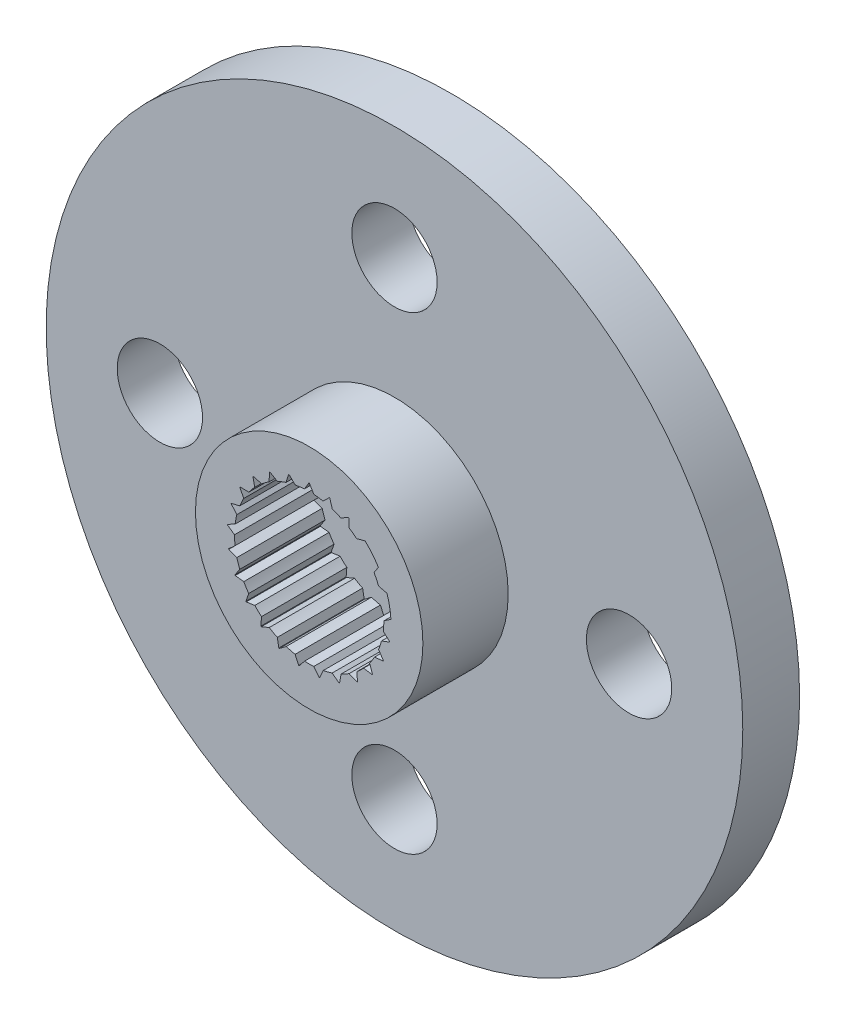
from build123d import *

# Parameters (mm, degrees)
SKETCH1_R           = 12.25
BOSS_EXTRUDE1_DEPTH = 2
SKETCH2_R           = 1.5
CUT_EXTRUDE1_DEPTH  = 2
SKETCH3_R           = 1.35
CUT_EXTRUDE2_DEPTH  = 4
SKETCH4_R           = 4
SKETCH4_R_2         = 2.88
BOSS_EXTRUDE2_DEPTH = 3
SKETCH6_R           = 2
CUT_EXTRUDE3_DEPTH  = 1
BOSS_EXTRUDE4_START = -3
BOSS_EXTRUDE4_DEPTH = 3


with BuildPart() as part:
    # Sketch1 → Boss-Extrude1 (new body)
    with BuildSketch(Plane.XY):
        Circle(SKETCH1_R)
    extrude(amount=BOSS_EXTRUDE1_DEPTH)

    # Sketch2 → Cut-Extrude1 (cut)
    with BuildSketch(Plane.XY.offset(2)):
        with Locations((-8.25, 0)):
            Circle(SKETCH2_R)
        with Locations((0, 8.25)):
            Circle(SKETCH2_R)
        with Locations((8.25, 0)):
            Circle(SKETCH2_R)
        with Locations((0, -8.25)):
            Circle(SKETCH2_R)
    extrude(amount=-CUT_EXTRUDE1_DEPTH, mode=Mode.SUBTRACT)

    # Sketch3 → Cut-Extrude2 (cut)
    with BuildSketch(Plane.XY.offset(2)):
        Circle(SKETCH3_R)
    extrude(amount=-CUT_EXTRUDE2_DEPTH, mode=Mode.SUBTRACT)

    # Sketch4 → Boss-Extrude2 (add)
    with BuildSketch(Plane.XY.offset(2)):
        Circle(SKETCH4_R)
        Circle(SKETCH4_R_2, mode=Mode.SUBTRACT)
    extrude(amount=BOSS_EXTRUDE2_DEPTH)

    # Sketch6 → Cut-Extrude3 (cut)
    with BuildSketch(Plane(origin=(0, 0, 0), x_dir=(-1, 0, 0), z_dir=(0, 0, -1))):
        Circle(SKETCH6_R)
    extrude(amount=-CUT_EXTRUDE3_DEPTH, mode=Mode.SUBTRACT)

    # Sketch5 → Boss-Extrude4 (add)
    with BuildSketch(Plane.XY.offset(5).offset(BOSS_EXTRUDE4_START)):
        with BuildLine():
            Line((-0.161756527, -2.620613729), (-0.351910166, -2.85841901))
            ThreePointArc((-0.351910166, -2.85841901), (0.000368858, -2.879999976), (0.352642342, -2.858328774))
            Line((0.352642342, -2.858328774), (0.162522941, -2.62056631))
            ThreePointArc((0.162522941, -2.62056631), (0.00038394, -2.625601139), (-0.161756527, -2.620613729))
        make_face()
        with BuildLine():
            ThreePointArc((-1.051714162, -2.681100021), (-0.715869599, -2.789611212), (-0.369274025, -2.856227703))
            Line((-0.369274025, -2.856227703), (-0.494291356, -2.578654212))
            ThreePointArc((-0.494291356, -2.578654212), (-0.652588574, -2.543208533), (-0.808394781, -2.498055117))
            Line((-0.808394781, -2.498055117), (-1.051714162, -2.681100021))
        make_face()
        with BuildLine():
            Line((0.495045485, -2.578509542), (0.37000564, -2.85613302))
            ThreePointArc((0.37000564, -2.85613302), (0.716584139, -2.78942775), (1.052400895, -2.680830535))
            Line((1.052400895, -2.680830535), (0.809125323, -2.497818589))
            ThreePointArc((0.809125323, -2.497818589), (0.653332329, -2.54301757), (0.495045485, -2.578509542))
        make_face()
        with BuildLine():
            ThreePointArc((-1.685435089, -2.335317657), (-1.387127337, -2.523940917), (-1.067987548, -2.674659342))
            Line((-1.067987548, -2.674659342), (-1.12004751, -2.374715787))
            ThreePointArc((-1.12004751, -2.374715787), (-1.264556547, -2.301016782), (-1.404238617, -2.218534516))
            Line((-1.404238617, -2.218534516), (-1.685435089, -2.335317657))
        make_face()
        with BuildLine():
            Line((1.120741967, -2.374388118), (1.068672631, -2.674385688))
            ThreePointArc((1.068672631, -2.674385688), (1.387773803, -2.523585519), (1.686033229, -2.334885854))
            Line((1.686033229, -2.334885854), (1.404887387, -2.218123739))
            ThreePointArc((1.404887387, -2.218123739), (1.265229445, -2.300646853), (1.120741967, -2.374388118))
        make_face()
        with BuildLine():
            ThreePointArc((-2.213253931, -1.842798696), (-1.971226763, -2.09968213), (-1.699595485, -2.325032298))
            Line((-1.699595485, -2.325032298), (-1.675426958, -2.021565235))
            ThreePointArc((-1.675426958, -2.021565235), (-1.797067781, -1.914243684), (-1.911848977, -1.799615231))
            Line((-1.911848977, -1.799615231), (-2.213253931, -1.842798696))
        make_face()
        with BuildLine():
            Line((1.676018111, -2.021075155), (1.70019099, -2.324596868))
            ThreePointArc((1.70019099, -2.324596868), (1.971764535, -2.099177129), (2.213725894, -1.842231708))
            Line((2.213725894, -1.842231708), (1.912375208, -1.799056017))
            ThreePointArc((1.912375208, -1.799056017), (1.797627541, -1.913718034), (1.676018111, -2.021075155))
        make_face()
        with BuildLine():
            ThreePointArc((-2.602005889, -1.234489916), (-2.431466761, -1.543492594), (-2.224411588, -1.829314923))
            Line((-2.224411588, -1.829314923), (-2.12553317, -1.541392304))
            ThreePointArc((-2.12553317, -1.541392304), (-2.216662638, -1.407191614), (-2.299330835, -1.267619503))
            Line((-2.299330835, -1.267619503), (-2.602005889, -1.234489916))
        make_face()
        with BuildLine():
            Line((2.125983872, -1.540770608), (2.224880096, -1.828745077))
            ThreePointArc((2.224880096, -1.828745077), (2.43186205, -1.54286972), (2.60232202, -1.233823368))
            Line((2.60232202, -1.233823368), (2.299701462, -1.26694699))
            ThreePointArc((2.299701462, -1.26694699), (2.217074088, -1.406543272), (2.125983872, -1.540770608))
        make_face()
        with BuildLine():
            ThreePointArc((-2.827264247, -0.548613595), (-2.738928761, -0.890319741), (-2.609459729, -1.218654964))
            Line((-2.609459729, -1.218654964), (-2.442084315, -0.964368026))
            ThreePointArc((-2.442084315, -0.964368026), (-2.496976429, -0.811720521), (-2.542337279, -0.655974579))
            Line((-2.542337279, -0.655974579), (-2.827264247, -0.548613595))
        make_face()
        with BuildLine():
            Line((2.442366248, -0.963653777), (2.609771804, -1.217986508))
            ThreePointArc((2.609771804, -1.217986508), (2.739156728, -0.889618132), (2.827404683, -0.547889369))
            Line((2.827404683, -0.547889369), (2.542529016, -0.655231023))
            ThreePointArc((2.542529016, -0.655231023), (2.497213717, -0.810990224), (2.442366248, -0.963653777))
        make_face()
        with BuildLine():
            ThreePointArc((-2.874875195, 0.171734137), (-2.874293794, -0.181204825), (-2.830545919, -0.531422432))
            Line((-2.830545919, -0.531422432), (-2.605190321, -0.326748959))
            ThreePointArc((-2.605190321, -0.326748959), (-2.620396008, -0.165246042), (-2.625599323, -0.00311236))
            Line((-2.625599323, -0.00311236), (-2.874875195, 0.171734137))
        make_face()
        with BuildLine():
            Line((2.60528577, -0.325987035), (2.830681951, -0.530697366))
            ThreePointArc((2.830681951, -0.530697366), (2.874340115, -0.180468565), (2.874831111, 0.172470535))
            Line((2.874831111, 0.172470535), (2.625600121, -0.002344481))
            ThreePointArc((2.625600121, -0.002344481), (2.620444223, -0.164479678), (2.60528577, -0.325987035))
        make_face()
        with BuildLine():
            ThreePointArc((-2.741847161, 0.881291181), (-2.829056376, 0.539295857), (-2.873778498, 0.189201326))
            Line((-2.873778498, 0.189201326), (-2.604602638, 0.331400948))
            ThreePointArc((-2.604602638, 0.331400948), (-2.579166468, 0.491611454), (-2.543885305, 0.64994542))
            Line((-2.543885305, 0.64994542), (-2.741847161, 0.881291181))
        make_face()
        with BuildLine():
            ThreePointArc((-2.436538786, 1.535473459), (-2.606058942, 1.225910597), (-2.736441006, 0.897936869))
            Line((-2.736441006, 0.897936869), (-2.440358193, 0.968727714))
            ThreePointArc((-2.440358193, 0.968727714), (-2.375878414, 1.117579194), (-2.302329617, 1.262164738))
            Line((-2.302329617, 1.262164738), (-2.436538786, 1.535473459))
        make_face()
        with BuildLine():
            ThreePointArc((-1.978133718, 2.093176293), (-2.21931324, 1.835496865), (-2.427162861, 1.550251736))
            Line((-2.427162861, 1.550251736), (-2.122777067, 1.545185755))
            ThreePointArc((-2.122777067, 1.545185755), (-2.023305181, 1.673325323), (-1.916110092, 1.795077605))
            Line((-1.916110092, 1.795077605), (-1.978133718, 2.093176293))
        make_face()
        with BuildLine():
            Line((2.440995413, 0.967120926), (2.73696806, 0.89632909))
            ThreePointArc((2.73696806, 0.89632909), (2.605878342, 1.226294446), (2.435183429, 1.537622082))
            Line((2.435183429, 1.537622082), (2.282024688, 1.298516389))
            ThreePointArc((2.282024688, 1.298516389), (2.367316087, 1.135603819), (2.440995413, 0.967120926))
        make_face()
        with BuildLine():
            ThreePointArc((-1.395435234, 2.519357162), (-1.693119925, 2.329752115), (-1.965377147, 2.105158585))
            Line((-1.965377147, 2.105158585), (-1.671814051, 2.024554092))
            ThreePointArc((-1.671814051, 2.024554092), (-1.543600242, 2.123930268), (-1.409494323, 2.215199143))
            Line((-1.409494323, 2.215199143), (-1.395435234, 2.519357162))
        make_face()
        with BuildLine():
            ThreePointArc((-0.725056422, 2.787237554), (-1.060541659, 2.677620472), (-1.380099559, 2.527790578))
            Line((-1.380099559, 2.527790578), (-1.115804809, 2.37671225))
            ThreePointArc((-1.115804809, 2.37671225), (-0.966905223, 2.441080863), (-0.814314842, 2.496131573))
            Line((-0.814314842, 2.496131573), (-0.725056422, 2.787237554))
        make_face()
        with BuildLine():
            ThreePointArc((-0.009119648, 2.879985561), (-0.361325659, 2.857244086), (-0.70810524, 2.791592192))
            Line((-0.70810524, 2.791592192), (-0.489685448, 2.579532836))
            ThreePointArc((-0.489685448, 2.579532836), (-0.329455993, 2.60484937), (-0.167968964, 2.620222876))
            Line((-0.167968964, 2.620222876), (-0.009119648, 2.879985561))
        make_face()
        with BuildLine():
            Line((1.671221881, 2.025042942), (1.964837844, 2.10566195))
            ThreePointArc((1.964837844, 2.10566195), (1.6925231, 2.330185734), (1.394789851, 2.519714522))
            Line((1.394789851, 2.519714522), (1.408846409, 2.215611267))
            ThreePointArc((1.408846409, 2.215611267), (1.542979014, 2.124381616), (1.671221881, 2.025042942))
        make_face()
        with BuildLine():
            ThreePointArc((0.707390147, 2.791773483), (0.36059376, 2.857336547), (0.008381935, 2.879987803))
            Line((0.008381935, 2.879987803), (0.167202651, 2.620271888))
            ThreePointArc((0.167202651, 2.620271888), (0.328694169, 2.604945611), (0.488931021, 2.579675939))
            Line((0.488931021, 2.579675939), (0.707390147, 2.791773483))
        make_face()
        with BuildLine():
            Line((1.115109672, 2.377038475), (1.379452017, 2.52814401))
            ThreePointArc((1.379452017, 2.52814401), (1.059855747, 2.677892043), (0.724342443, 2.787423187))
            Line((0.724342443, 2.787423187), (0.813584792, 2.49636962))
            ThreePointArc((0.813584792, 2.49636962), (0.966191267, 2.441363538), (1.115109672, 2.377038475))
        make_face()
    extrude(amount=BOSS_EXTRUDE4_DEPTH)


solid = part.part
